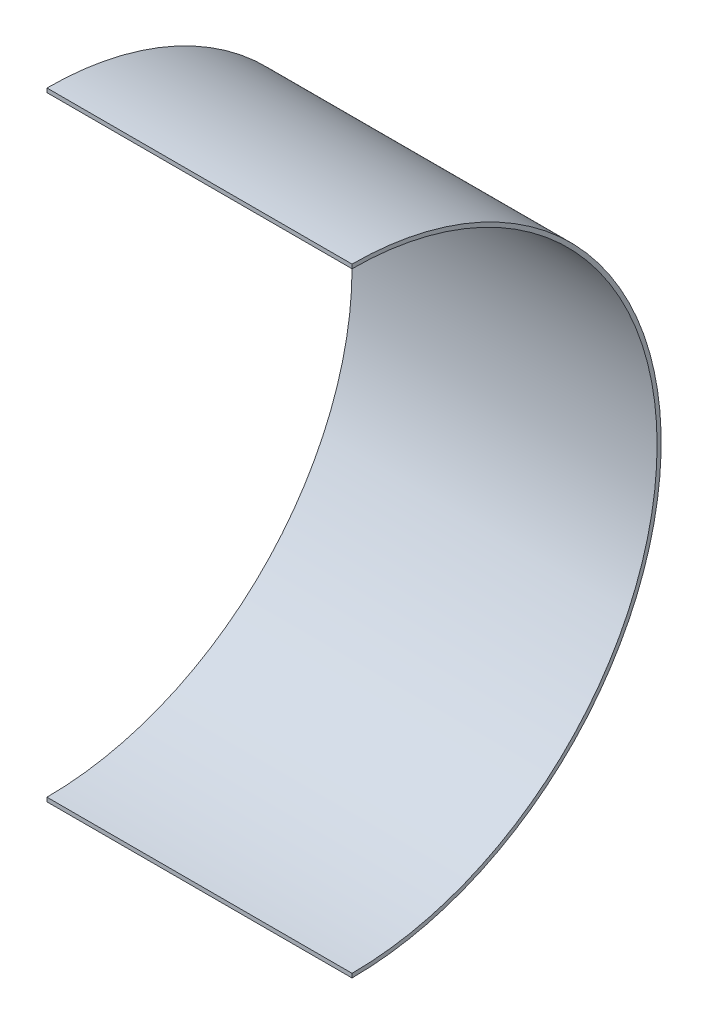
from build123d import *

# Parameters (mm, degrees)
EXTRUDE_THIN1_DEPTH = 190.5


with BuildPart() as part:
    # Sketch1 → Extrude-Thin1 (new body)
    with BuildSketch(Plane(origin=(0, 0, 0), x_dir=(0, 0, -1), z_dir=(1, 0, 0))):
        with BuildLine():
            ThreePointArc((0, -190.5), (190.5, 0), (0, 190.5))
            Line((0, 190.5), (0, 193.04))
            ThreePointArc((0, 193.04), (193.04, 0), (0, -193.04))
            Line((0, -193.04), (0, -190.5))
        make_face()
    extrude(amount=EXTRUDE_THIN1_DEPTH)


solid = part.part
